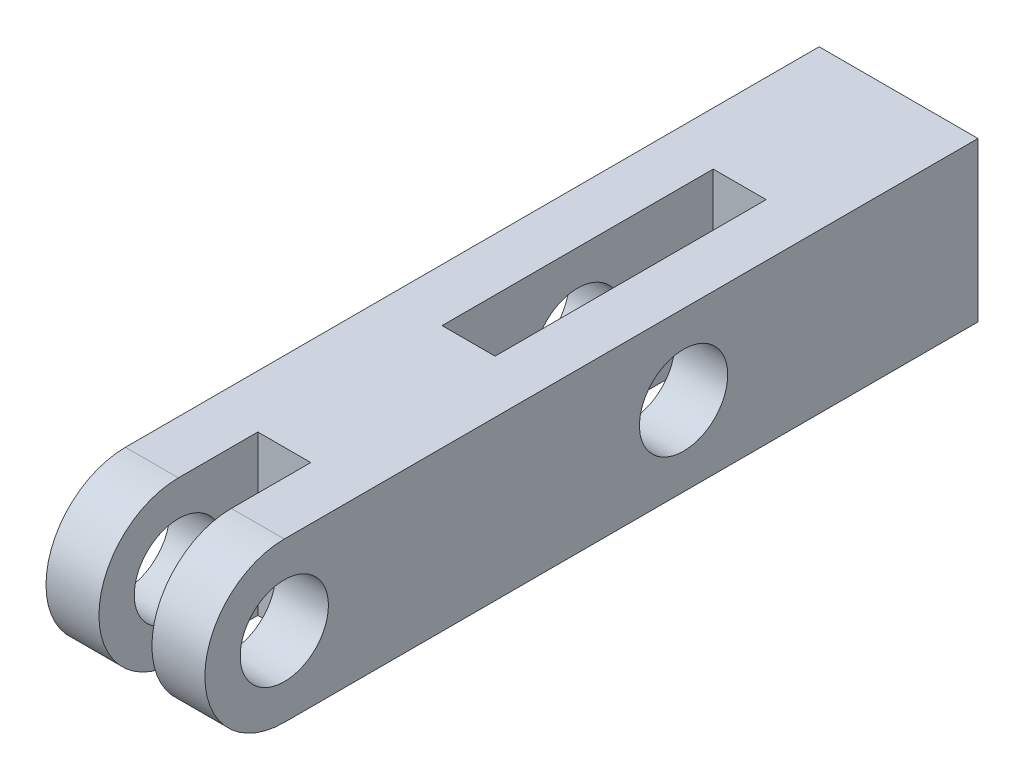
from build123d import *

# Parameters (mm, degrees)
SKETCH1_W             = 3
SKETCH1_H             = 9
BOSS_EXTRUDE1_DEPTH   = 9
BOSS_EXTRUDE1_2_DEPTH = 9
SKETCH2_W             = 9
SKETCH2_H             = 9
BOSS_EXTRUDE2_DEPTH   = 10.44
SKETCH3_W             = 3
SKETCH3_H             = 9
BOSS_EXTRUDE3_DEPTH   = 15.36
SKETCH4_W             = 9
SKETCH4_H             = 9
BOSS_EXTRUDE4_DEPTH   = 9
SKETCH5_R             = 2.5
CUT_EXTRUDE1_DEPTH    = 38.054554376
CUT_EXTRUDE5_DEPTH    = 38.054554376


with BuildPart() as part:
    # Sketch1 → Boss-Extrude1 (new body)
    with BuildSketch(Plane.XY):
        with Locations((1.5, 4.5)):
            Rectangle(SKETCH1_W, SKETCH1_H)
    extrude(amount=BOSS_EXTRUDE1_DEPTH)



with BuildPart() as body_2:
    # Sketch1 → Boss-Extrude1 2 (new body)
    with BuildSketch(Plane.XY):
        with Locations((7.5, 4.5)):
            Rectangle(SKETCH1_W, SKETCH1_H)
    extrude(amount=BOSS_EXTRUDE1_2_DEPTH)


with BuildPart() as part_1:
    add(part.part)

    add(body_2.part)  # Boss-Extrude2 merges body 2
    # Sketch2 → Boss-Extrude2 (add)
    with BuildSketch(Plane(origin=(0, 0, 0), x_dir=(-1, 0, 0), z_dir=(0, 0, -1))):
        with Locations((-4.5, 4.5)):
            Rectangle(SKETCH2_W, SKETCH2_H)
    extrude(amount=BOSS_EXTRUDE2_DEPTH)

    # Sketch3 → Boss-Extrude3 (add)
    with BuildSketch(Plane(origin=(0, 0, -10.44), x_dir=(-1, 0, 0), z_dir=(0, 0, -1))):
        with Locations((-7.5, 4.5)):
            Rectangle(SKETCH3_W, SKETCH3_H)
        with Locations((-1.5, 4.5)):
            Rectangle(SKETCH3_W, SKETCH3_H)
    extrude(amount=BOSS_EXTRUDE3_DEPTH)

    # Sketch4 → Boss-Extrude4 (add)
    with BuildSketch(Plane(origin=(0, 0, -25.8), x_dir=(-1, 0, 0), z_dir=(0, 0, -1))):
        with Locations((-4.5, 4.5)):
            Rectangle(SKETCH4_W, SKETCH4_H)
    extrude(amount=BOSS_EXTRUDE4_DEPTH)

    # Sketch5 → Cut-Extrude1 (cut, through all)
    with BuildSketch(Plane(origin=(9, 0, 0), x_dir=(0, 0, -1), z_dir=(1, 0, 0))):
        with Locations((18.12, 4.5)):
            Circle(SKETCH5_R)
    extrude(amount=-CUT_EXTRUDE1_DEPTH, mode=Mode.SUBTRACT)

    # Sketch6 → Cut-Extrude5 (cut, through all)
    with BuildSketch(Plane(origin=(9, 0, 0), x_dir=(0, 0, -1), z_dir=(1, 0, 0))):
        with BuildLine():
            ThreePointArc((-9, 4.5), (-7.681980515, 7.681980515), (-4.5, 9))
            Line((-4.5, 9), (-9, 9))
            Line((-9, 9), (-9, 4.5))
        make_face()
        with BuildLine():
            ThreePointArc((-4.5, 0), (-7.681980515, 1.318019485), (-9, 4.5))
            Line((-9, 4.5), (-9, 0))
            Line((-9, 0), (-4.5, 0))
        make_face()
        with BuildLine():
            ThreePointArc((-2, 4.5), (-2.732233047, 6.267766953), (-4.5, 7))
            Line((-4.5, 7), (-4.5, 2))
            ThreePointArc((-4.5, 2), (-2.732233047, 2.732233047), (-2, 4.5))
        make_face()
        with BuildLine():
            Line((-4.5, 2), (-4.5, 7))
            ThreePointArc((-4.5, 7), (-7, 4.5), (-4.5, 2))
        make_face()
    extrude(amount=-CUT_EXTRUDE5_DEPTH, mode=Mode.SUBTRACT)


solid = part_1.part
